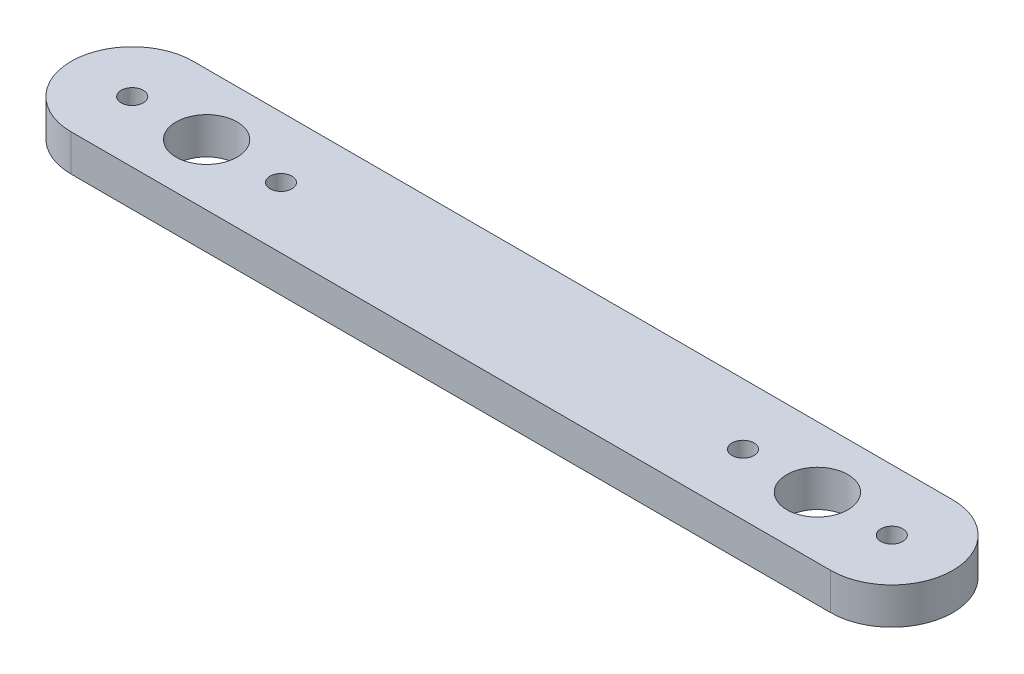
from build123d import *

# Parameters (mm, degrees)
CROQUIS1_R              = 2.5
CROQUIS1_R_2            = 0.9
SALIENTE_EXTRUIR1_DEPTH = 3


with BuildPart() as part:
    # Croquis1 → Saliente-Extruir1 (new body)
    with BuildSketch(Plane(origin=(0, 0, 0), x_dir=(1, 0, 0), z_dir=(0, 1, 0))):
        with BuildLine():
            Line((-31.09, 5), (31.09, 5))
            ThreePointArc((31.09, 5), (36.09, 0), (31.09, -5))
            Line((31.09, -5), (-31.09, -5))
            ThreePointArc((-31.09, -5), (-36.09, 0), (-31.09, 5))
        make_face()
        with Locations(Location((-25, 0, 0), (0, 0, 270))):
            Circle(CROQUIS1_R, mode=Mode.SUBTRACT)
        with Locations(Location((25, 0, 0), (0, 0, 270))):
            Circle(CROQUIS1_R, mode=Mode.SUBTRACT)
        with Locations(Location((-18.91, 0, 0), (0, 0, 270))):
            Circle(CROQUIS1_R_2, mode=Mode.SUBTRACT)
        with Locations(Location((18.91, 0, 0), (0, 0, 270))):
            Circle(CROQUIS1_R_2, mode=Mode.SUBTRACT)
        with Locations(Location((-31.09, 0, 0), (0, 0, 270))):
            Circle(CROQUIS1_R_2, mode=Mode.SUBTRACT)
        with Locations(Location((31.09, 0, 0), (0, 0, 270))):
            Circle(CROQUIS1_R_2, mode=Mode.SUBTRACT)
    extrude(amount=SALIENTE_EXTRUIR1_DEPTH)


solid = part.part
